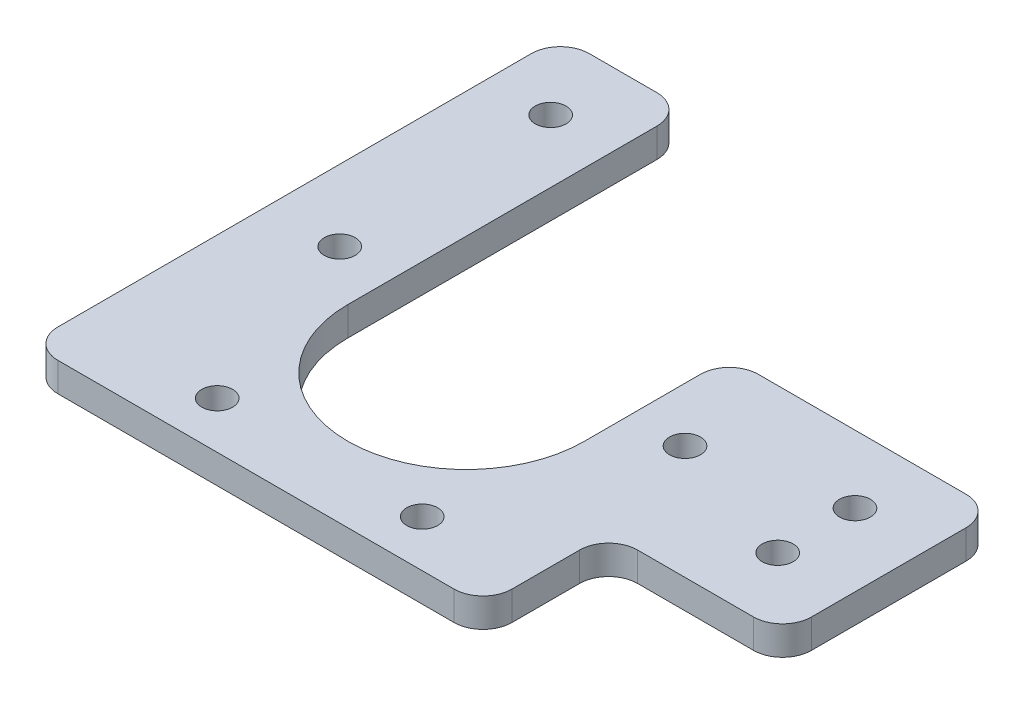
from build123d import *

# Parameters (mm, degrees)
SKETCH_1_R      = 1.6
EXTRUDE_1_DEPTH = 3
FILLET_1_R      = 3


with BuildPart() as part:
    # 草图1 → 凸台-拉伸1 (new body)
    with BuildSketch(Plane(origin=(0, 0, 0), x_dir=(1, 0, 0), z_dir=(0, 1, 0))):
        with BuildLine():
            Line((-17, 57.5), (-17, 72.5))
            Line((-17, 72.5), (-30, 72.5))
            Line((-30, 72.5), (-30, 17.5))
            Line((-30, 17.5), (17, 17.5))
            Line((17, 17.5), (17, 30.5))
            Line((17, 30.5), (35, 30.5))
            Line((35, 30.5), (35, 52.5))
            Line((35, 52.5), (7.5, 52.5))
            Line((7.5, 52.5), (7.5, 37.5))
            ThreePointArc((7.5, 37.5), (-4.75, 25.25), (-17, 37.5))
            Line((-17, 37.5), (-17, 57.5))
        make_face()
        with Locations(Location((-23.5, 65, 0), (0, 0, 270))):
            Circle(SKETCH_1_R, mode=Mode.SUBTRACT)
        with Locations(Location((27.5, 45.5, 0), (0, 0, 270))):
            Circle(SKETCH_1_R, mode=Mode.SUBTRACT)
        with Locations(Location((27.5, 37.5, 0), (0, 0, 270))):
            Circle(SKETCH_1_R, mode=Mode.SUBTRACT)
        with Locations(Location((-22.619627786, 42.288152334, 0), (0, 0, 270))):
            Circle(SKETCH_1_R, mode=Mode.SUBTRACT)
        with Locations(Location((-15.361164072, 22.345687181, 0), (0, 0, 90))):
            Circle(SKETCH_1_R, mode=Mode.SUBTRACT)
        with Locations(Location((5.861164072, 22.345687181, 0), (0, 0, 270))):
            Circle(SKETCH_1_R, mode=Mode.SUBTRACT)
        with Locations(Location((13.119627786, 42.288152334, 0), (0, 0, 90))):
            Circle(SKETCH_1_R, mode=Mode.SUBTRACT)
    extrude(amount=EXTRUDE_1_DEPTH)

    # 圆角1
    fillet_1_edges = [part.edges().sort_by_distance(p)[0] for p in [
        (7.5, 1.5, -52.5),
        (35, 1.5, -52.5),
        (35, 1.5, -30.5),
        (17, 1.5, -30.5),
        (17, 1.5, -17.5),
        (-30, 1.5, -17.5),
        (-30, 1.5, -72.5),
        (-17, 1.5, -72.5),
    ]]
    fillet(fillet_1_edges, radius=FILLET_1_R)


solid = part.part
